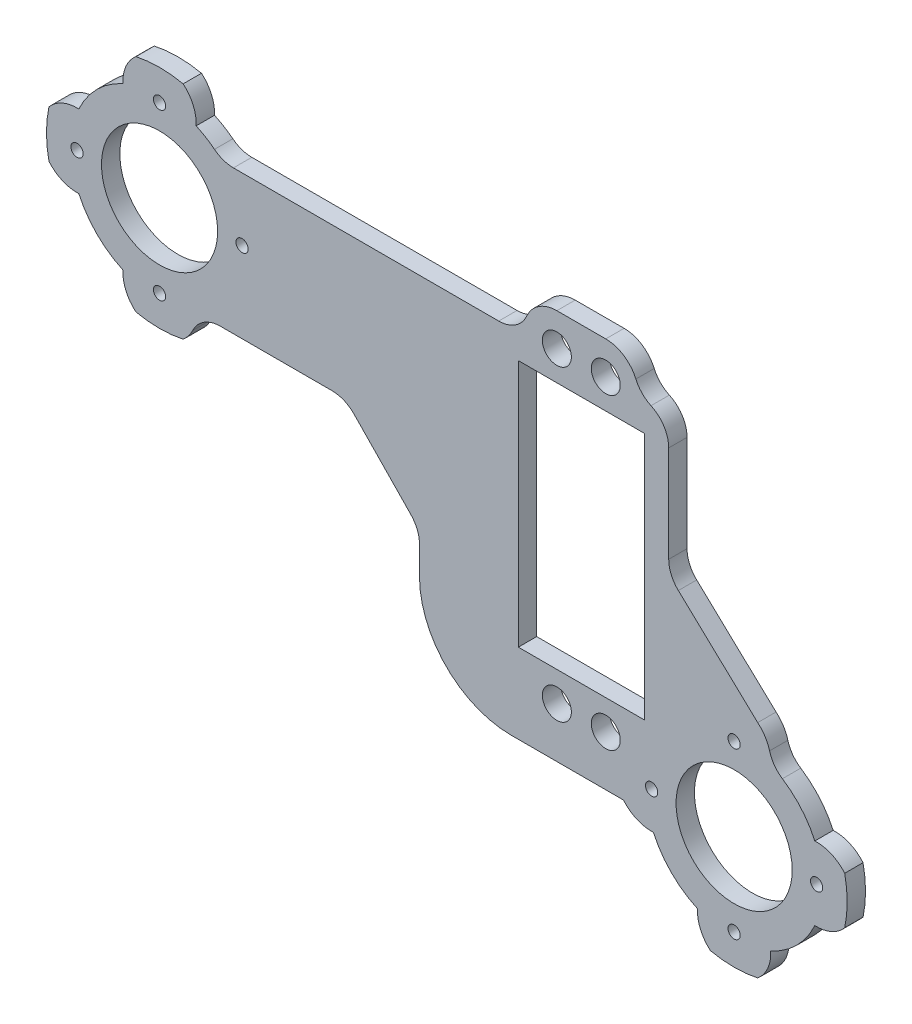
from build123d import *

# Parameters (mm, degrees)
SKETCH13_R          = 1
SKETCH13_R_2        = 9.5
BOSS_EXTRUDE1_DEPTH = 3
BOSS_EXTRUDE2_DEPTH = 3
BOSS_EXTRUDE4_DEPTH = 3
FILLET1_R           = 5
FILLET2_R           = 5
FILLET3_R           = 15


with BuildPart() as part:
    # Sketch13 → Boss-Extrude1 (new body)
    with BuildSketch(Plane.XY):
        with BuildLine():
            ThreePointArc((-5.992679576, 13.203703704), (-10.253048327, 10.253048327), (-13.203703704, 5.992679576))
            ThreePointArc((-13.203703704, 5.992679576), (-15.898009243, 5.499959243), (-18.092592593, 3.861100009))
            ThreePointArc((-18.092592593, 3.861100009), (-18.5, 0), (-18.092592593, -3.861100009))
            ThreePointArc((-18.092592593, -3.861100009), (-15.898009243, -5.499959243), (-13.203703704, -5.992679576))
            ThreePointArc((-13.203703704, -5.992679576), (-10.253048327, -10.253048327), (-5.992679576, -13.203703704))
            ThreePointArc((-5.992679576, -13.203703704), (-5.499959243, -15.898009243), (-3.861100009, -18.092592593))
            ThreePointArc((-3.861100009, -18.092592593), (0, -18.5), (3.861100009, -18.092592593))
            ThreePointArc((3.861100009, -18.092592593), (5.499959243, -15.898009243), (5.992679576, -13.203703704))
            ThreePointArc((5.992679576, -13.203703704), (10.253048327, -10.253048327), (13.203703704, -5.992679576))
            ThreePointArc((13.203703704, -5.992679576), (15.898009243, -5.499959243), (18.092592593, -3.861100009))
            ThreePointArc((18.092592593, -3.861100009), (18.5, 0), (18.092592593, 3.861100009))
            ThreePointArc((18.092592593, 3.861100009), (15.898009243, 5.499959243), (13.203703704, 5.992679576))
            ThreePointArc((13.203703704, 5.992679576), (10.253048327, 10.253048327), (5.992679576, 13.203703704))
            ThreePointArc((5.992679576, 13.203703704), (5.499959243, 15.898009243), (3.861100009, 18.092592593))
            ThreePointArc((3.861100009, 18.092592593), (0, 18.5), (-3.861100009, 18.092592593))
            ThreePointArc((-3.861100009, 18.092592593), (-5.499959243, 15.898009243), (-5.992679576, 13.203703704))
        make_face()
        with Locations((-13.5, 0)):
            Circle(SKETCH13_R, mode=Mode.SUBTRACT)
        with Locations((0, -13.5)):
            Circle(SKETCH13_R, mode=Mode.SUBTRACT)
        Circle(SKETCH13_R_2, mode=Mode.SUBTRACT)
        with Locations((13.5, 0)):
            Circle(SKETCH13_R, mode=Mode.SUBTRACT)
        with Locations((0, 13.5)):
            Circle(SKETCH13_R, mode=Mode.SUBTRACT)
    extrude(amount=BOSS_EXTRUDE1_DEPTH)


with BuildPart() as body_2:
    # Body-Move/Copy1: copy of part
    add(part.part.moved(Location((-94, 43.5, 0))))


with BuildPart() as part_1:
    add(part.part)

    # Sketch14 → Boss-Extrude2 (add)
    with BuildSketch(Plane(origin=(0, 0, 0), x_dir=(-1, 0, 0), z_dir=(0, 0, -1))):
        with BuildLine():
            Line((31.316921449, 49.8), (35.3, 49.8))
            Line((35.3, 49.8), (35.3, 9.2))
            Line((35.3, 9.2), (31.316921449, 9.2))
            ThreePointArc((31.316921449, 9.2), (33.30493166, 7.568413958), (34.307365166, 5.2))
            Line((34.307365166, 5.2), (39.3, 5.2))
            Line((39.3, 5.2), (39.3, 53.8))
            Line((39.3, 53.8), (34.307365166, 53.8))
            ThreePointArc((34.307365166, 53.8), (33.30493166, 51.431586042), (31.316921449, 49.8))
        make_face()
        with BuildLine():
            Line((14.7, 49.8), (18.683078551, 49.8))
            ThreePointArc((18.683078551, 49.8), (16.69506834, 51.431586042), (15.692634834, 53.8))
            Line((15.692634834, 53.8), (10.7, 53.8))
            Line((10.7, 53.8), (10.7, 9.785703858))
            ThreePointArc((10.7, 9.785703858), (12.101385086, 7.987895781), (13.203703704, 5.992679576))
            ThreePointArc((13.203703704, 5.992679576), (14.506837812, 5.914919917), (15.762309194, 5.557153688))
            ThreePointArc((15.762309194, 5.557153688), (16.806478342, 7.71229105), (18.683078551, 9.2))
            Line((18.683078551, 9.2), (14.7, 9.2))
            Line((14.7, 9.2), (14.7, 49.8))
        make_face()
        with BuildLine():
            Line((18.683078551, 49.8), (23.316921449, 49.8))
            ThreePointArc((23.316921449, 49.8), (24.220644755, 50.34673701), (25, 51.059648346))
            ThreePointArc((25, 51.059648346), (24.1487998, 52.335592598), (23.692634834, 53.8))
            Line((23.692634834, 53.8), (23.217684603, 53.8))
            ThreePointArc((23.217684603, 53.8), (21, 52.275), (18.782315397, 53.8))
            Line((18.782315397, 53.8), (15.692634834, 53.8))
            ThreePointArc((15.692634834, 53.8), (16.69506834, 51.431586042), (18.683078551, 49.8))
        make_face()
        with BuildLine():
            Line((26.683078551, 49.8), (31.316921449, 49.8))
            ThreePointArc((31.316921449, 49.8), (33.30493166, 51.431586042), (34.307365166, 53.8))
            Line((34.307365166, 53.8), (31.217684603, 53.8))
            ThreePointArc((31.217684603, 53.8), (29, 52.275), (26.782315397, 53.8))
            Line((26.782315397, 53.8), (26.307365166, 53.8))
            ThreePointArc((26.307365166, 53.8), (25.8512002, 52.335592598), (25, 51.059648346))
            ThreePointArc((25, 51.059648346), (25.779355245, 50.34673701), (26.683078551, 49.8))
        make_face()
        with BuildLine():
            ThreePointArc((34.307365166, 5.2), (33.30493166, 7.568413958), (31.316921449, 9.2))
            Line((31.316921449, 9.2), (26.683078551, 9.2))
            ThreePointArc((26.683078551, 9.2), (25.779355245, 8.65326299), (25, 7.940351654))
            ThreePointArc((25, 7.940351654), (25.8512002, 6.664407402), (26.307365166, 5.2))
            Line((26.307365166, 5.2), (26.782315397, 5.2))
            ThreePointArc((26.782315397, 5.2), (29, 6.725), (31.217684603, 5.2))
            Line((31.217684603, 5.2), (34.307365166, 5.2))
        make_face()
        with BuildLine():
            ThreePointArc((25, 7.940351654), (24.220644755, 8.65326299), (23.316921449, 9.2))
            Line((23.316921449, 9.2), (18.683078551, 9.2))
            ThreePointArc((18.683078551, 9.2), (16.806478342, 7.71229105), (15.762309194, 5.557153688))
            ThreePointArc((15.762309194, 5.557153688), (16.133878277, 5.390981842), (16.493325909, 5.2))
            Line((16.493325909, 5.2), (18.782315397, 5.2))
            ThreePointArc((18.782315397, 5.2), (21, 6.725), (23.217684603, 5.2))
            Line((23.217684603, 5.2), (23.692634834, 5.2))
            ThreePointArc((23.692634834, 5.2), (24.1487998, 6.664407402), (25, 7.940351654))
        make_face()
        with BuildLine():
            ThreePointArc((25, 7.940351654), (25.779355245, 8.65326299), (26.683078551, 9.2))
            Line((26.683078551, 9.2), (23.316921449, 9.2))
            ThreePointArc((23.316921449, 9.2), (24.220644755, 8.65326299), (25, 7.940351654))
        make_face()
        with BuildLine():
            ThreePointArc((26.307365166, 5.2), (25.8512002, 6.664407402), (25, 7.940351654))
            ThreePointArc((25, 7.940351654), (24.1487998, 6.664407402), (23.692634834, 5.2))
            Line((23.692634834, 5.2), (26.307365166, 5.2))
        make_face()
        with BuildLine():
            Line((26.307365166, 5.2), (23.692634834, 5.2))
            ThreePointArc((23.692634834, 5.2), (23.843844234, 2.83188185), (25, 0.759648346))
            ThreePointArc((25, 0.759648346), (26.019493251, 2.427680438), (26.375, 4.35))
            ThreePointArc((26.375, 4.35), (26.358064612, 4.77634331), (26.307365166, 5.2))
        make_face()
        with BuildLine():
            ThreePointArc((34.375, 4.35), (34.358064612, 4.77634331), (34.307365166, 5.2))
            Line((34.307365166, 5.2), (31.217684603, 5.2))
            ThreePointArc((31.217684603, 5.2), (31.335340011, 4.782217577), (31.375, 4.35))
            ThreePointArc((31.375, 4.35), (28.567782423, 2.014659989), (26.782315397, 5.2))
            Line((26.782315397, 5.2), (26.307365166, 5.2))
            ThreePointArc((26.307365166, 5.2), (26.358064612, 4.77634331), (26.375, 4.35))
            ThreePointArc((26.375, 4.35), (26.019493251, 2.427680438), (25, 0.759648346))
            ThreePointArc((25, 0.759648346), (30.922319562, -0.669493251), (34.375, 4.35))
        make_face()
        with BuildLine():
            ThreePointArc((25, 0.759648346), (23.843844234, 2.83188185), (23.692634834, 5.2))
            Line((23.692634834, 5.2), (23.217684603, 5.2))
            ThreePointArc((23.217684603, 5.2), (23.335340011, 4.782217577), (23.375, 4.35))
            ThreePointArc((23.375, 4.35), (20.567782423, 2.014659989), (18.782315397, 5.2))
            Line((18.782315397, 5.2), (16.493325909, 5.2))
            ThreePointArc((16.493325909, 5.2), (17.351584502, 4.600575706), (18.092592593, 3.861100009))
            ThreePointArc((18.092592593, 3.861100009), (18.418055295, 1.739321458), (18.495547193, -0.405874382))
            ThreePointArc((18.495547193, -0.405874382), (21.948038058, -0.940732354), (25, 0.759648346))
        make_face()
        with BuildLine():
            ThreePointArc((23.692634834, 53.8), (24.1487998, 52.335592598), (25, 51.059648346))
            ThreePointArc((25, 51.059648346), (25.8512002, 52.335592598), (26.307365166, 53.8))
            Line((26.307365166, 53.8), (23.692634834, 53.8))
        make_face()
        with BuildLine():
            ThreePointArc((25, 58.240351654), (23.843844234, 56.16811815), (23.692634834, 53.8))
            Line((23.692634834, 53.8), (26.307365166, 53.8))
            ThreePointArc((26.307365166, 53.8), (26.358064612, 54.22365669), (26.375, 54.65))
            ThreePointArc((26.375, 54.65), (26.019493251, 56.572319562), (25, 58.240351654))
        make_face()
        with BuildLine():
            Line((31.217684603, 53.8), (34.307365166, 53.8))
            ThreePointArc((34.307365166, 53.8), (34.358064612, 54.22365669), (34.375, 54.65))
            ThreePointArc((34.375, 54.65), (30.922319562, 59.669493251), (25, 58.240351654))
            ThreePointArc((25, 58.240351654), (26.019493251, 56.572319562), (26.375, 54.65))
            ThreePointArc((26.375, 54.65), (26.358064612, 54.22365669), (26.307365166, 53.8))
            Line((26.307365166, 53.8), (26.782315397, 53.8))
            ThreePointArc((26.782315397, 53.8), (28.567782423, 56.985340011), (31.375, 54.65))
            ThreePointArc((31.375, 54.65), (31.335340011, 54.217782423), (31.217684603, 53.8))
        make_face()
        with BuildLine():
            Line((23.217684603, 53.8), (23.692634834, 53.8))
            ThreePointArc((23.692634834, 53.8), (23.843844234, 56.16811815), (25, 58.240351654))
            ThreePointArc((25, 58.240351654), (18.685592598, 59.5012002), (15.692634834, 53.8))
            Line((15.692634834, 53.8), (18.782315397, 53.8))
            ThreePointArc((18.782315397, 53.8), (20.567782423, 56.985340011), (23.375, 54.65))
            ThreePointArc((23.375, 54.65), (23.335340011, 54.217782423), (23.217684603, 53.8))
        make_face()
        with BuildLine():
            Line((23.316921449, 49.8), (26.683078551, 49.8))
            ThreePointArc((26.683078551, 49.8), (25.779355245, 50.34673701), (25, 51.059648346))
            ThreePointArc((25, 51.059648346), (24.220644755, 50.34673701), (23.316921449, 49.8))
        make_face()
    extrude(amount=-BOSS_EXTRUDE2_DEPTH)

    add(body_2.part)  # Boss-Extrude4 merges body 2
    # Sketch15 → Boss-Extrude4 (add)
    with BuildSketch(Plane(origin=(0, 0, 0), x_dir=(-1, 0, 0), z_dir=(0, 0, -1))):
        with BuildLine():
            Line((39.3, 5.2), (34.307365166, 5.2))
            ThreePointArc((34.307365166, 5.2), (33.090194066, 0.862746424), (29, -1.025))
            Line((29, -1.025), (51.476830106, -1.025))
            Line((51.476830106, -1.025), (51.476830106, 17.748148148))
            Line((51.476830106, 17.748148148), (39.3, 5.2))
        make_face()
        Polygon((39.3, 30.296296296), (39.3, 5.2), (51.476830106, 17.748148148), (63.653660212, 30.296296296), align=None)
        with BuildLine():
            Line((39.3, 53.8), (39.3, 30.296296296))
            Line((39.3, 30.296296296), (63.653660212, 30.296296296))
            Line((63.653660212, 30.296296296), (88.007320424, 30.296296296))
            ThreePointArc((88.007320424, 30.296296296), (83.746951673, 33.246951673), (80.796296296, 37.507320424))
            ThreePointArc((80.796296296, 37.507320424), (78.101990757, 38.000040757), (75.907407407, 39.638899991))
            ThreePointArc((75.907407407, 39.638899991), (75.5, 43.5), (75.907407407, 47.361100009))
            ThreePointArc((75.907407407, 47.361100009), (78.101990757, 48.999959243), (80.796296296, 49.492679576))
            ThreePointArc((80.796296296, 49.492679576), (82.098722241, 51.783090468), (83.794119342, 53.8))
            Line((83.794119342, 53.8), (39.3, 53.8))
        make_face()
        with BuildLine():
            Line((10.7, 9.785703858), (10.7, 31.792851929))
            Line((10.7, 31.792851929), (-3.861100009, 18.092592593))
            ThreePointArc((-3.861100009, 18.092592593), (0, 18.5), (3.861100009, 18.092592593))
            ThreePointArc((3.861100009, 18.092592593), (5.499959243, 15.898009243), (5.992679576, 13.203703704))
            ThreePointArc((5.992679576, 13.203703704), (8.519511054, 11.733197834), (10.7, 9.785703858))
        make_face()
        with BuildLine():
            ThreePointArc((25, 58.240351654), (26.809967482, 59.558602914), (29, 60.025))
            Line((29, 60.025), (21, 60.025))
            ThreePointArc((21, 60.025), (23.190032518, 59.558602914), (25, 58.240351654))
        make_face()
        with BuildLine():
            Line((51.476830106, -1.025), (29, -1.025))
            ThreePointArc((29, -1.025), (26.809967482, -0.558602914), (25, 0.759648346))
            ThreePointArc((25, 0.759648346), (21.948038058, -0.940732354), (18.495547193, -0.405874382))
            ThreePointArc((18.495547193, -0.405874382), (18.375462968, -2.142979402), (18.092592593, -3.861100009))
            Line((18.092592593, -3.861100009), (51.476830106, -3.861100009))
            Line((51.476830106, -3.861100009), (51.476830106, -1.025))
        make_face()
    extrude(amount=-BOSS_EXTRUDE4_DEPTH)

    # Fillet1
    fillet1_edges = [part_1.edges().sort_by_distance(p)[0] for p in [
        (5.992679576, 13.203703704, 1.5),
        (-15.692634834, 53.8, 1.5),
        (-34.307365166, 53.8, 1.5),
        (-10.7, 31.792851929, 1.5),
        (-88.007320424, 30.296296296, 1.5),
        (-83.794119342, 53.8, 1.5),
        (-63.653660212, 30.296296296, 1.5),
        (-51.476830106, 17.748148148, 1.5),
    ]]
    fillet(fillet1_edges, radius=FILLET1_R)

    # Fillet2
    fillet2_edges = [part_1.edges().sort_by_distance(p)[0] for p in [
        (-10.7, 53.8, 1.5),
    ]]
    fillet(fillet2_edges, radius=FILLET2_R)

    # Fillet3
    fillet3_edges = [part_1.edges().sort_by_distance(p)[0] for p in [
        (-51.476830106, -3.861100009, 1.5),
    ]]
    fillet(fillet3_edges, radius=FILLET3_R)


solid = part_1.part
